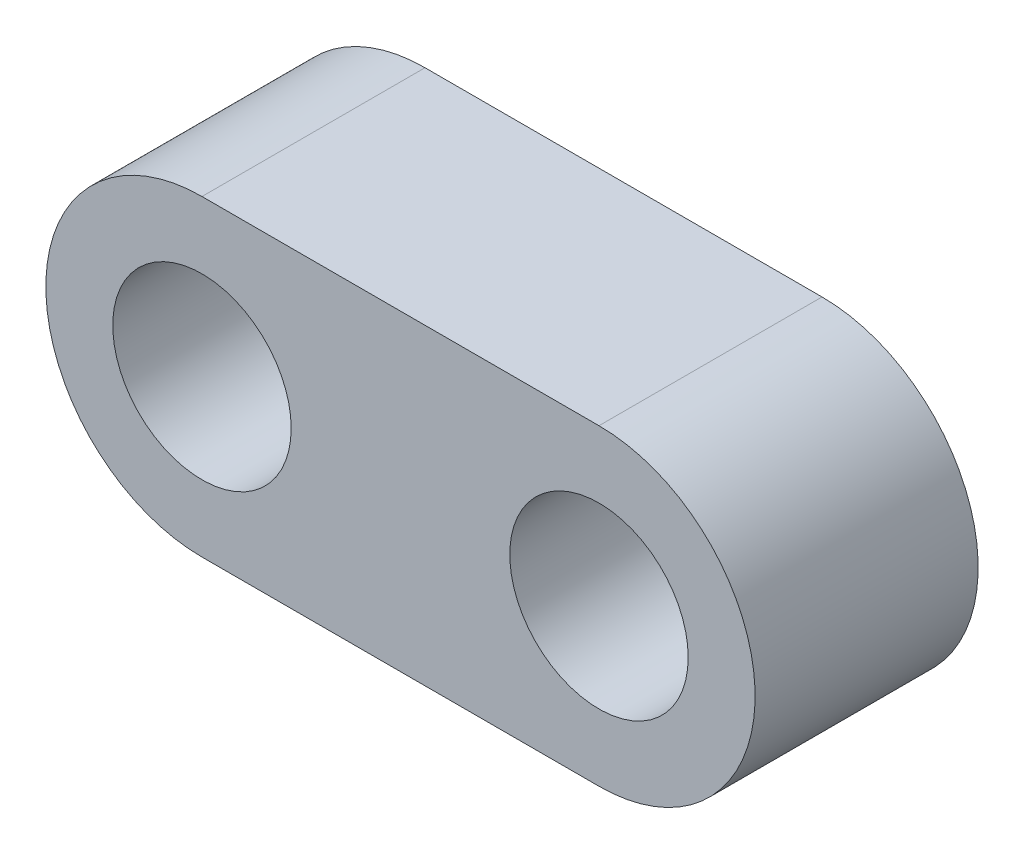
from build123d import *

# Parameters (mm, degrees)
SKETCH_2_R      = 20
EXTRUDE_1_DEPTH = 50


with BuildPart() as part:
    # 草图2 → 凸台-拉伸1 (new body)
    with BuildSketch(Plane.XY):
        with BuildLine():
            Line((0, 35), (89, 35))
            ThreePointArc((89, 35), (124, 0), (89, -35))
            Line((89, -35), (0, -35))
            ThreePointArc((0, -35), (-35, 0), (0, 35))
        make_face()
        Circle(SKETCH_2_R, mode=Mode.SUBTRACT)
        with Locations((89, 0)):
            Circle(SKETCH_2_R, mode=Mode.SUBTRACT)
    extrude(amount=EXTRUDE_1_DEPTH)


solid = part.part
